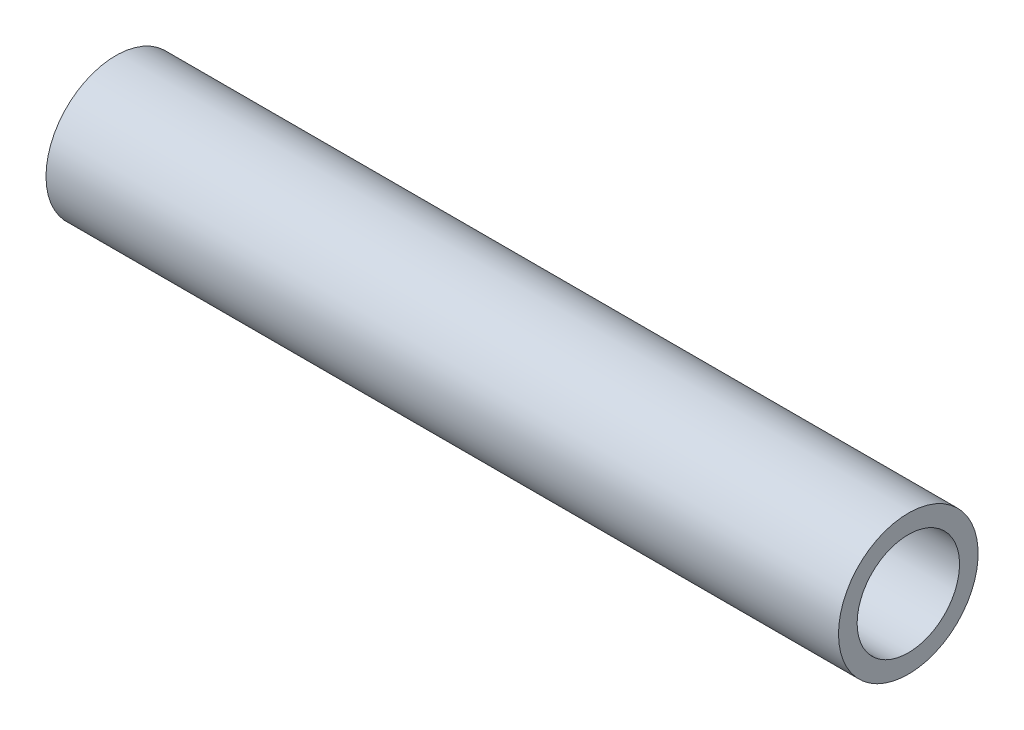
from build123d import *

# Parameters (mm, degrees)
AXIAL_PROFILE_MM_W = 25.5409558
AXIAL_PROFILE_MM_H = 0.6


with BuildPart() as part:
    # Axial profile (mm) → Full revolution (revolve)
    with BuildSketch(Plane.XY, mode=Mode.PRIVATE) as full_revolution_sk:
        with Locations((12.7704779, 1.95)):
            Rectangle(AXIAL_PROFILE_MM_W, AXIAL_PROFILE_MM_H)
    revolve(full_revolution_sk.sketch.rotate(Axis((-110, 0, 0), (1, 0, 0)), 90), axis=Axis((-110, 0, 0), (1, 0, 0)))


solid = part.part
